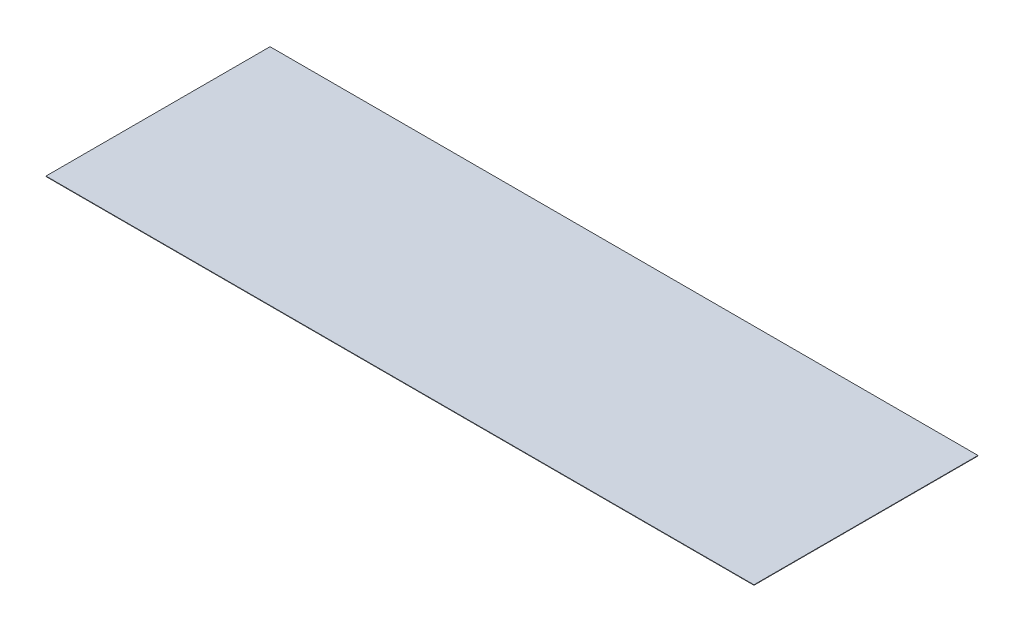
from build123d import *

# Parameters (mm, degrees)
SKETCH1_W           = 7900
SKETCH1_H           = 2500
BOSS_EXTRUDE1_DEPTH = 5


with BuildPart() as part:
    # Sketch1 → Boss-Extrude1 (new body)
    with BuildSketch(Plane(origin=(0, 0, 0), x_dir=(1, 0, 0), z_dir=(0, 1, 0))):
        Rectangle(SKETCH1_W, SKETCH1_H)
    extrude(amount=BOSS_EXTRUDE1_DEPTH)


solid = part.part
